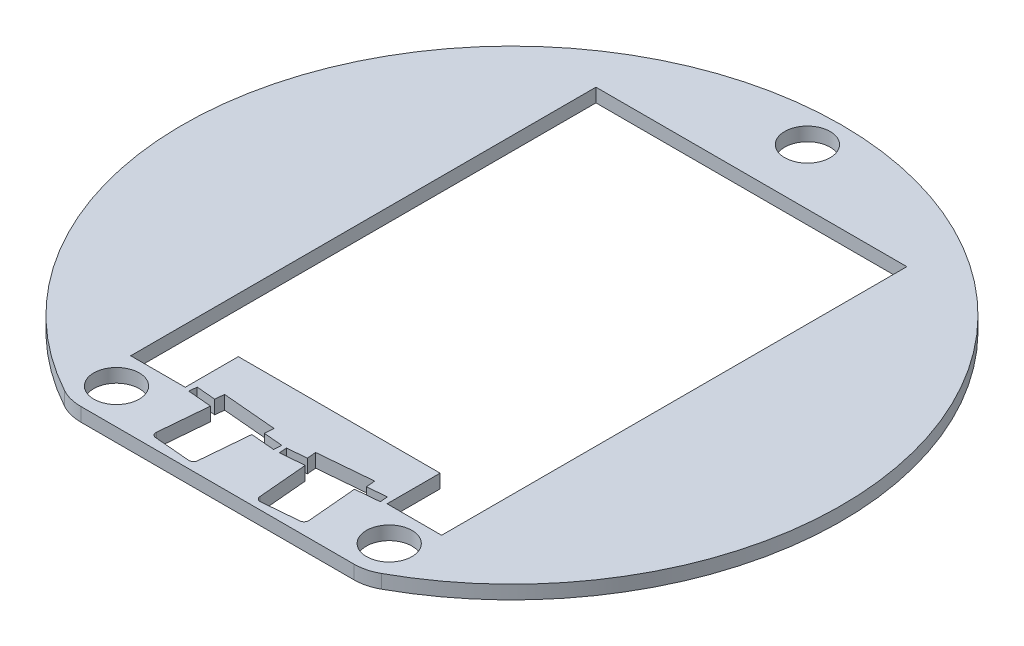
from build123d import *

# Parameters (mm, degrees)
BOSS_EXTRUDE1_DEPTH = 3
CUT_EXTRUDE1_DEPTH  = 103.574363269
CUT_EXTRUDE3_DEPTH  = 103.574363269
CUT_EXTRUDE4_DEPTH  = 103.574363269
SKETCH6_W           = 68.4
SKETCH6_H           = 3
CUT_EXTRUDE5_DEPTH  = 103.574363269
SKETCH7_R           = 5
CUT_EXTRUDE6_DEPTH  = 103.574363269
SKETCH11_R          = 5
CUT_EXTRUDE10_DEPTH = 103.574363269


with BuildPart() as part:
    # Sketch1 → Boss-Extrude1 (new body)
    with BuildSketch(Plane(origin=(0, 0, 0), x_dir=(1, 0, 0), z_dir=(0, 1, 0))):
        with BuildLine():
            Line((-30.029977361, -64.812867647), (30.029977361, -64.812867647))
            ThreePointArc((30.029977361, -64.812867647), (32.509837414, -64.500503794), (34.834773739, -63.582926471))
            ThreePointArc((34.834773739, -63.582926471), (0, 72.5), (-34.834773739, -63.582926471))
            ThreePointArc((-34.834773739, -63.582926471), (-32.509837414, -64.500503794), (-30.029977361, -64.812867647))
        make_face()
    extrude(amount=BOSS_EXTRUDE1_DEPTH)

    # Sketch2 → Cut-Extrude1 (cut, through all)
    with BuildSketch(Plane(origin=(0, 3, 0), x_dir=(1, 0, 0), z_dir=(0, 1, 0))):
        Polygon((-22.2, -49.675685802), (-22.2, -38), (22.2, -38), (22.2, -49.675685802), (34.2, -49.675685802), (34.2, 49.675685802), (22.2, 49.675685802), (22.2, 44), (-22.2, 44), (-22.2, 49.675685802), (-34.2, 49.675685802), (-34.2, -49.675685802), align=None)
    extrude(amount=-CUT_EXTRUDE1_DEPTH, mode=Mode.SUBTRACT)

    # Sketch4 → Cut-Extrude3 (cut, through all)
    with BuildSketch(Plane(origin=(0, 3, 0), x_dir=(1, 0, 0), z_dir=(0, 1, 0))):
        Polygon((-21.070156074, -50.026174921), (-0.648164763, -51.812867647), (-0.5, -50.11933666), (-20.921991311, -48.332643934), align=None)
        Polygon((21.070156074, -50.026174921), (20.921991311, -48.332643934), (0.5, -50.11933666), (0.648164763, -51.812867647), align=None)
    extrude(amount=-CUT_EXTRUDE3_DEPTH, mode=Mode.SUBTRACT)

    # Sketch5 → Cut-Extrude4 (cut, through all)
    with BuildSketch(Plane(origin=(0, 3, 0), x_dir=(1, 0, 0), z_dir=(0, 1, 0))):
        with BuildLine():
            Line((5.878186928, -51.355299998), (15.840133909, -50.48374257))
            Line((15.840133909, -50.48374257), (16.798847079, -61.441884249))
            ThreePointArc((16.798847079, -61.441884249), (16.568696824, -62.171827602), (15.889808123, -62.52523469))
            Line((15.889808123, -62.52523469), (7.920250539, -63.222480632))
            ThreePointArc((7.920250539, -63.222480632), (7.190307186, -62.992330377), (6.836900098, -62.313441677))
            Line((6.836900098, -62.313441677), (5.878186928, -51.355299998))
        make_face()
        Polygon((16.688163844, -48.703055841), (4.733827467, -49.748924754), (4.559515981, -47.756535357), (16.513852358, -46.710666444), align=None)
        Polygon((-16.513852358, -46.710666444), (-4.559515981, -47.756535357), (-4.733827467, -49.748924754), (-16.688163844, -48.703055841), align=None)
        with BuildLine():
            Line((-7.920250539, -63.222480632), (-15.889808123, -62.52523469))
            ThreePointArc((-15.889808123, -62.52523469), (-16.568696824, -62.171827602), (-16.798847079, -61.441884249))
            Line((-16.798847079, -61.441884249), (-15.840133909, -50.48374257))
            Line((-15.840133909, -50.48374257), (-5.878186928, -51.355299998))
            Line((-5.878186928, -51.355299998), (-6.836900098, -62.313441677))
            ThreePointArc((-6.836900098, -62.313441677), (-7.190307186, -62.992330377), (-7.920250539, -63.222480632))
        make_face()
    extrude(amount=-CUT_EXTRUDE4_DEPTH, mode=Mode.SUBTRACT)

    # Sketch6 → Cut-Extrude5 (cut, through all)
    with BuildSketch(Plane(origin=(0, 3, 0), x_dir=(1, 0, 0), z_dir=(0, 1, 0))):
        with Locations((0, 51.175685802)):
            Rectangle(SKETCH6_W, SKETCH6_H)
    extrude(amount=-CUT_EXTRUDE5_DEPTH, mode=Mode.SUBTRACT)


with BuildPart() as cut_extrude5_kept_piece:
    # of the separate pieces the step leaves, the one the design keeps (cut_extrude5_pieces_kept)
    add(part.part.solids().sort_by_distance((-34.834773739, 0, 63.582926471))[0])

    # Sketch7 → Cut-Extrude6 (cut, through all)
    with BuildSketch(Plane(origin=(0, 3, 0), x_dir=(1, 0, 0), z_dir=(0, 1, 0))):
        with Locations(Location((-30, -57, 0), (0, 0, 270))):
            Circle(SKETCH7_R)
        with Locations(Location((30, -57, 0), (0, 0, 270))):
            Circle(SKETCH7_R)
    extrude(amount=-CUT_EXTRUDE6_DEPTH, mode=Mode.SUBTRACT)

    # Sketch11 → Cut-Extrude10 (cut, through all)
    with BuildSketch(Plane(origin=(0, 3, 0), x_dir=(1, 0, 0), z_dir=(0, 1, 0))):
        with Locations(Location((0, 65, 0), (0, 0, 270))):
            Circle(SKETCH11_R)
    extrude(amount=-CUT_EXTRUDE10_DEPTH, mode=Mode.SUBTRACT)


solid = cut_extrude5_kept_piece.part
